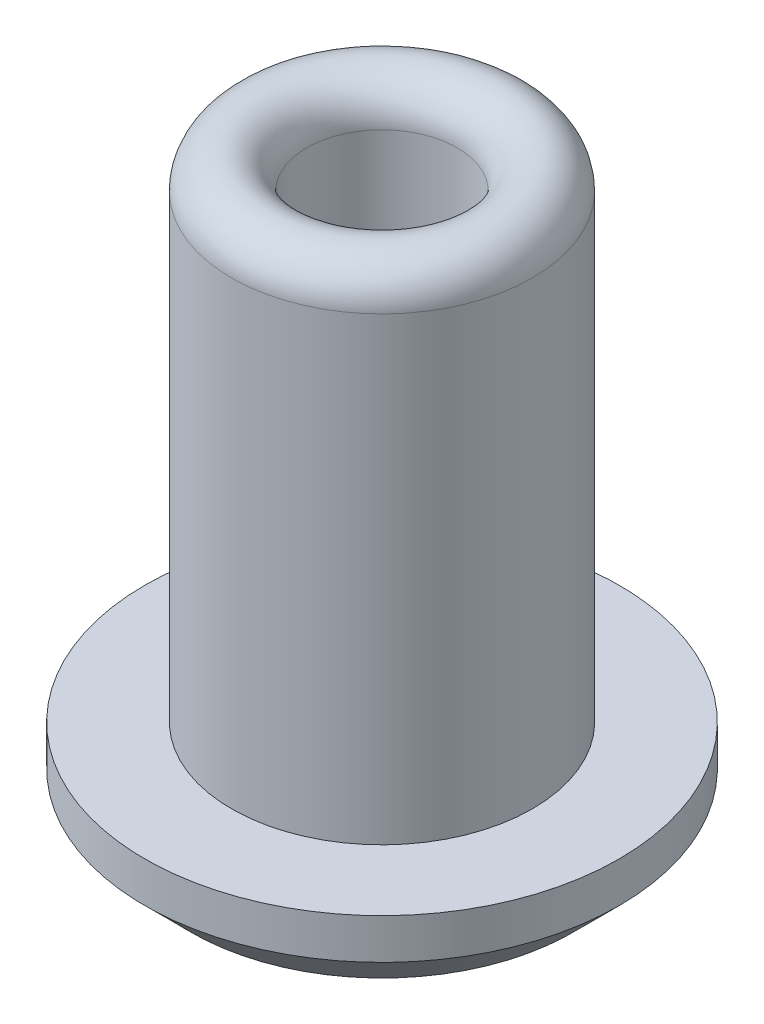
from build123d import *

# Parameters (mm, degrees)
CHAMFER1_SIZE = 0.8


with BuildPart() as part:
    # Sketch1 → Revolve1 (revolve)
    with BuildSketch(Plane.XY, mode=Mode.PRIVATE) as revolve1_sk:
        with BuildLine():
            Line((0, 0), (0, 0.5))
            Line((0, 0.5), (-0.3, 0.5))
            ThreePointArc((-0.3, 0.5), (-1.007106781, 0.792893219), (-1.3, 1.5))
            Line((-1.3, 1.5), (-1.3, 9.45))
            ThreePointArc((-1.3, 9.45), (-1.95, 10.1), (-2.6, 9.45))
            Line((-2.6, 9.45), (-2.6, 1.5))
            Line((-2.6, 1.5), (-4.1, 1.5))
            Line((-4.1, 1.5), (-4.1, 0))
            Line((-4.1, 0), (0, 0))
        make_face()
    revolve(revolve1_sk.sketch.rotate(Axis((0, -1000, 0), (0, 1, 0)), 180), axis=Axis((0, -1000, 0), (0, 1, 0)))

    # Chamfer1
    chamfer1_edges = [part.edges().sort_by_distance(p)[0] for p in [
        (-4.1, 0, 0),
    ]]
    chamfer(chamfer1_edges, length=CHAMFER1_SIZE)


solid = part.part
